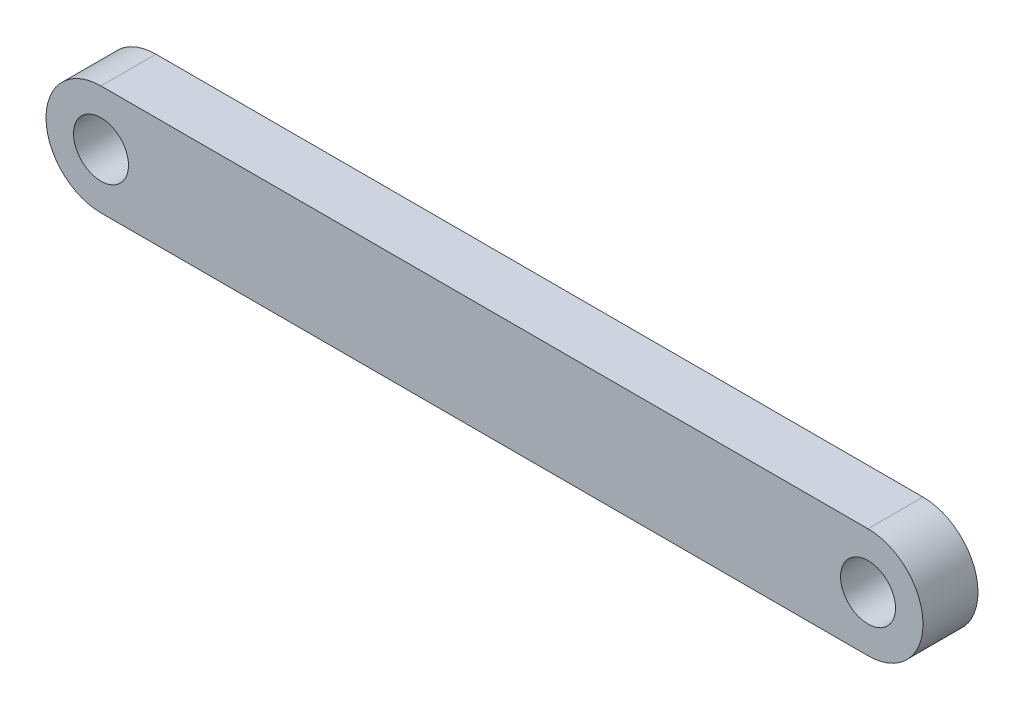
from build123d import *

# Parameters (mm, degrees)
SKETCH_1_R      = 1
EXTRUDE_1_DEPTH = 2


with BuildPart() as part:
    # 草圖1 → 填料-伸長1 (new body)
    with BuildSketch(Plane.XY):
        with BuildLine():
            Line((-13.949999981, 2.000719785), (13.950000019, 2.000719785))
            ThreePointArc((13.950000019, 2.000719785), (15.950000019, 0.000719785), (13.950000019, -1.999280215))
            Line((13.950000019, -1.999280215), (-13.949999981, -1.999280215))
            ThreePointArc((-13.949999981, -1.999280215), (-15.949999981, 0.000719785), (-13.949999981, 2.000719785))
        make_face()
        with Locations((-13.949999981, 0.000719785)):
            Circle(SKETCH_1_R, mode=Mode.SUBTRACT)
        with Locations((13.950000019, 0.000719785)):
            Circle(SKETCH_1_R, mode=Mode.SUBTRACT)
    extrude(amount=EXTRUDE_1_DEPTH)


solid = part.part
